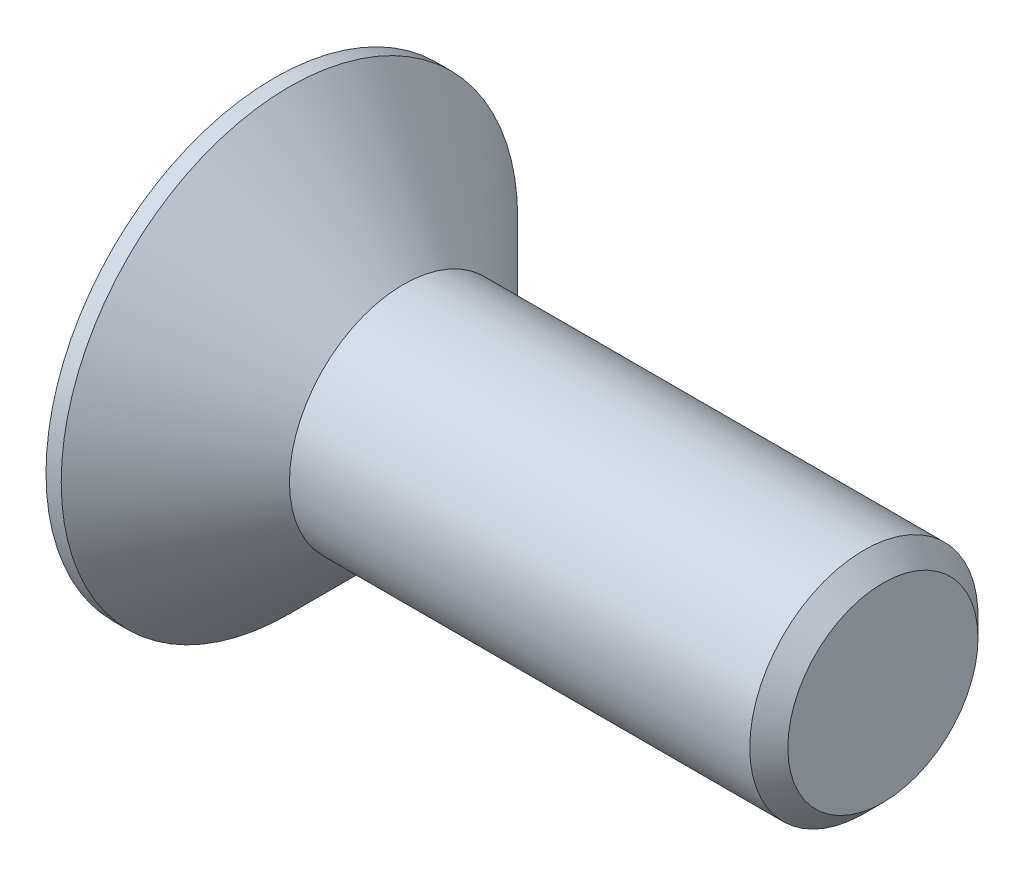
from build123d import *

# Parameters (mm, degrees)
CUT_EXTRUDE1_DEPTH = 0.8


with BuildPart() as part:
    # Sketch2 → Revolve1 (revolve)
    with BuildSketch(Plane.XY, mode=Mode.PRIVATE) as revolve1_sk:
        Polygon((0, 0), (0, 3), (0.2, 3), (1.7, 1.5), (7.75, 1.5), (8, 1.25), (8, 0), align=None)
    revolve(revolve1_sk.sketch.rotate(Axis((-2.281841559, 0, 0), (1, 0, 0)), 90), axis=Axis((-2.281841559, 0, 0), (1, 0, 0)))

    # Sketch3 → Cut-Extrude1 (cut)
    with BuildSketch(Plane.ZY):
        Polygon((0.721687836, -1.25), (1.443375673, 0), (0.721687836, 1.25), (-0.721687836, 1.25), (-1.443375673, 0), (-0.721687836, -1.25), align=None)
    extrude(amount=-CUT_EXTRUDE1_DEPTH, mode=Mode.SUBTRACT)


solid = part.part
